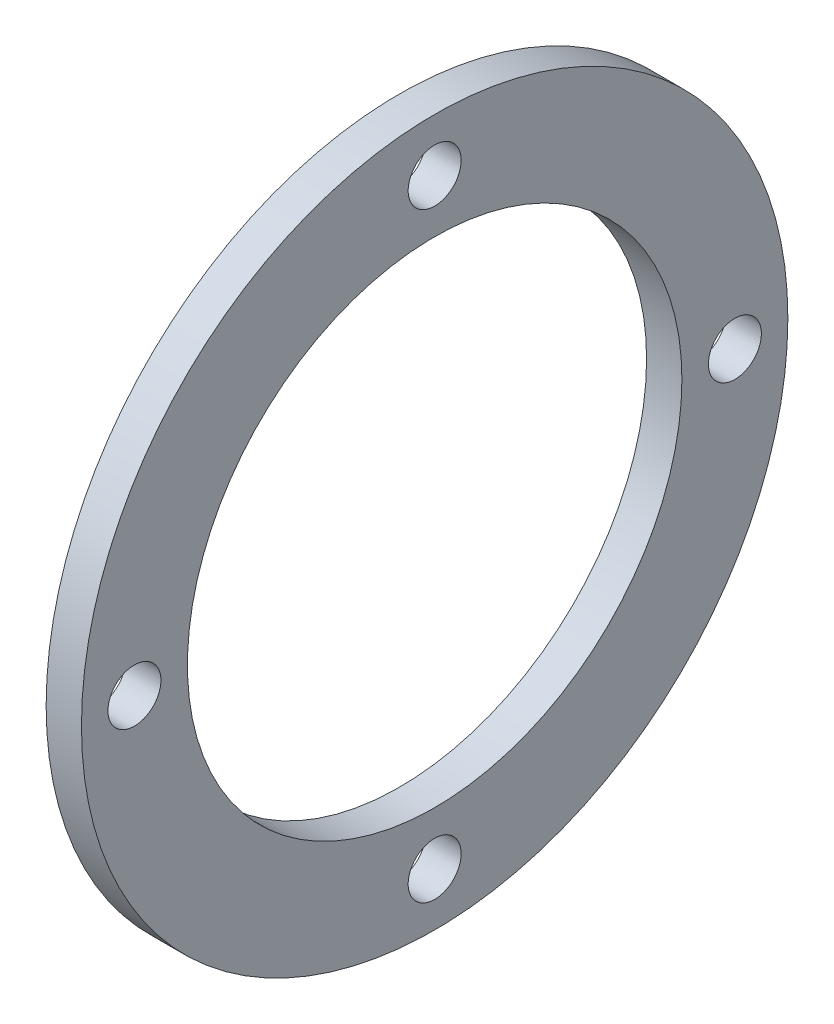
from build123d import *

# Parameters (mm, degrees)
SKETCH1_R           = 20
SKETCH1_R_2         = 14
SKETCH1_R_3         = 1.5
BOSS_EXTRUDE1_DEPTH = 2


with BuildPart() as part:
    # Sketch1 → Boss-Extrude1 (new body)
    with BuildSketch(Plane(origin=(0, 0, 0), x_dir=(0, 0, -1), z_dir=(1, 0, 0))):
        Circle(SKETCH1_R)
        Circle(SKETCH1_R_2, mode=Mode.SUBTRACT)
        with Locations((0, 17)):
            Circle(SKETCH1_R_3, mode=Mode.SUBTRACT)
        with Locations((17, 0)):
            Circle(SKETCH1_R_3, mode=Mode.SUBTRACT)
        with Locations((0, -17)):
            Circle(SKETCH1_R_3, mode=Mode.SUBTRACT)
        with Locations((-17, 0)):
            Circle(SKETCH1_R_3, mode=Mode.SUBTRACT)
    extrude(amount=BOSS_EXTRUDE1_DEPTH)


solid = part.part
